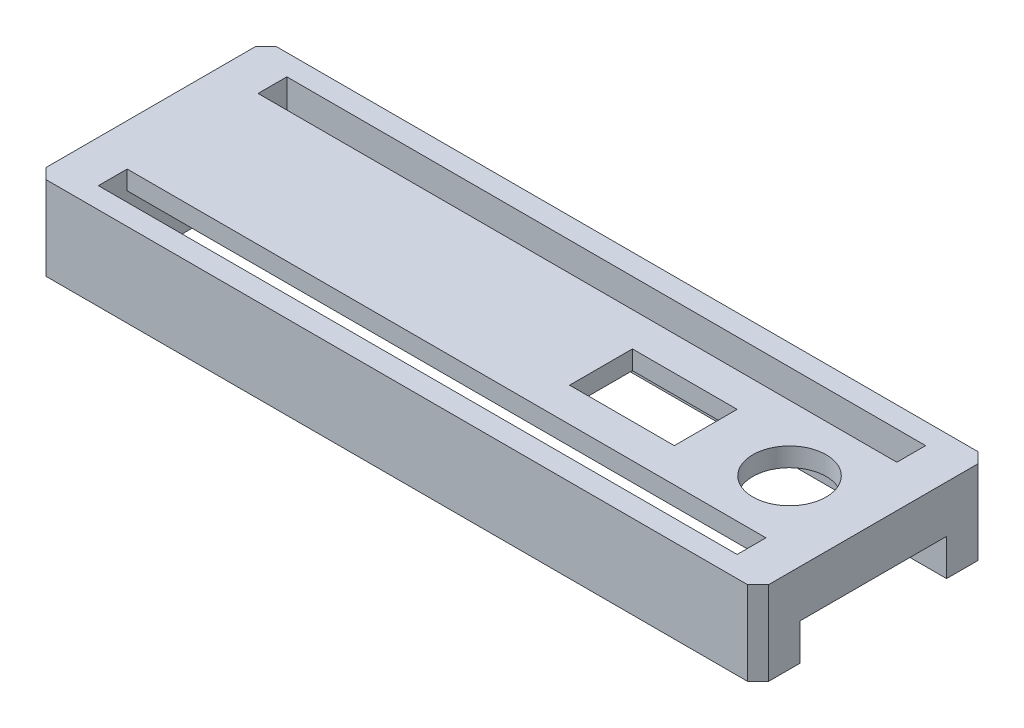
from build123d import *

# Parameters (mm, degrees)
SKETCH1_W                       = 70
SKETCH1_H                       = 12
BOSS_EXTRUDE1_DEPTH             = 1.8
SKETCH2_W                       = 4
SKETCH2_H                       = 18
BOSS_EXTRUDE2_DEPTH             = 8
BOSS_EXTRUDE3_REACH             = 40.58
SKETCH3_W                       = 5
SKETCH3_H                       = 18
BOSS_EXTRUDE3_DIRECTION_2_REACH = 40.58
SKETCH4_W                       = 5
SKETCH4_H                       = 14
CUT_EXTRUDE1_DEPTH              = 3.5
SKETCH5_W                       = 61
SKETCH5_H                       = 12.5
BOSS_EXTRUDE4_DEPTH             = 1.8
SKETCH7_W                       = 70
SKETCH7_H                       = 2
BOSS_EXTRUDE5_DEPTH             = 8
SKETCH10_R                      = 3.5
CUT_EXTRUDE2_DEPTH              = 1.8
SKETCH11_W                      = 10
SKETCH11_H                      = 6
CUT_EXTRUDE3_DEPTH              = 1.8
CUT_EXTRUDE4_START              = -8
SKETCH12_W                      = 1
SKETCH12_H                      = 22
CUT_EXTRUDE4_DEPTH              = 8
CHAMFER1_SIZE                   = 1


with BuildPart() as part:
    # Sketch1 → Boss-Extrude1 (new body)
    with BuildSketch(Plane(origin=(0, 0, 0), x_dir=(1, 0, 0), z_dir=(0, 1, 0))):
        with Locations((0, 6)):
            Rectangle(SKETCH1_W, SKETCH1_H)
    extrude(amount=BOSS_EXTRUDE1_DEPTH)

    # Sketch2 → Boss-Extrude2 (add)
    with BuildSketch(Plane(origin=(0, 1.8, 0), x_dir=(1, 0, 0), z_dir=(0, 1, 0))):
        with Locations((-33, 6)):
            Rectangle(SKETCH2_W, SKETCH2_H)
    extrude(amount=-BOSS_EXTRUDE2_DEPTH)

    # Boss-Extrude3: up to this face of the body (flat: up to its plane)
    boss_extrude3_end = Plane(part.part.faces().sort_by_distance((-33, -6.2, -6))[0])
    # Sketch3 → Boss-Extrude3 (add, up to the picked face)
    with BuildSketch(Plane.XZ, mode=Mode.PRIVATE) as boss_extrude3_sk1:
        with Locations((32.5, -6)):
            Rectangle(SKETCH3_W, SKETCH3_H)
    boss_extrude3_tool1 = split(extrude(boss_extrude3_sk1.sketch, amount=BOSS_EXTRUDE3_REACH, mode=Mode.PRIVATE), bisect_by=boss_extrude3_end, keep=Keep.BOTH, mode=Mode.PRIVATE)
    add(boss_extrude3_tool1.solids().sort_by(Axis((32.5, 0, -6), (0, -1, 0)))[0])

    # Boss-Extrude3 direction 2: up to this face of the body (flat: up to its plane)
    boss_extrude3_direction_2_end = Plane(part.part.faces().sort_by_distance((-0.916666667, 1.8, -6))[0])
    # Sketch3 → Boss-Extrude3 direction 2 (add, up to the picked face)
    with BuildSketch(Plane.XZ, mode=Mode.PRIVATE) as boss_extrude3_direction_2_sk1:
        with Locations((32.5, -6)):
            Rectangle(SKETCH3_W, SKETCH3_H)
    boss_extrude3_direction_2_tool1 = split(extrude(boss_extrude3_direction_2_sk1.sketch, amount=-BOSS_EXTRUDE3_DIRECTION_2_REACH, mode=Mode.PRIVATE), bisect_by=boss_extrude3_direction_2_end, keep=Keep.BOTH, mode=Mode.PRIVATE)
    add(boss_extrude3_direction_2_tool1.solids().sort_by(Axis((32.5, 0, -6), (0, 1, 0)))[0])

    # Sketch4 → Cut-Extrude1 (cut)
    with BuildSketch(Plane.XZ.offset(6.2)):
        with Locations((32.5, -6)):
            Rectangle(SKETCH4_W, SKETCH4_H)
    extrude(amount=-CUT_EXTRUDE1_DEPTH, mode=Mode.SUBTRACT)

    # Sketch5 → Boss-Extrude4 (add)
    with BuildSketch(Plane(origin=(0, 1.8, 0), x_dir=(1, 0, 0), z_dir=(0, 1, 0))):
        with Locations((-0.5, 6)):
            Rectangle(SKETCH5_W, SKETCH5_H)
    extrude(amount=-BOSS_EXTRUDE4_DEPTH)

    # Sketch7 → Boss-Extrude5 (add)
    with BuildSketch(Plane(origin=(0, 1.8, 0), x_dir=(1, 0, 0), z_dir=(0, 1, 0))):
        with Locations((0, 16)):
            Rectangle(SKETCH7_W, SKETCH7_H)
        with Locations((0, -4)):
            Rectangle(SKETCH7_W, SKETCH7_H)
    extrude(amount=-BOSS_EXTRUDE5_DEPTH)

    # Sketch10 → Cut-Extrude2 (cut)
    with BuildSketch(Plane(origin=(0, 1.8, 0), x_dir=(1, 0, 0), z_dir=(0, 1, 0))):
        with Locations(Location((26, 6, 0), (0, 0, 270))):
            Circle(SKETCH10_R)
    extrude(amount=-CUT_EXTRUDE2_DEPTH, mode=Mode.SUBTRACT)

    # Sketch11 → Cut-Extrude3 (cut)
    with BuildSketch(Plane(origin=(0, 1.8, 0), x_dir=(1, 0, 0), z_dir=(0, 1, 0))):
        with Locations((13, 6)):
            Rectangle(SKETCH11_W, SKETCH11_H)
    extrude(amount=-CUT_EXTRUDE3_DEPTH, mode=Mode.SUBTRACT)

    # Sketch12 → Cut-Extrude4 (cut)
    with BuildSketch(Plane(origin=(0, 1.8, 0), x_dir=(1, 0, 0), z_dir=(0, 1, 0)).offset(CUT_EXTRUDE4_START)):
        with Locations((34.5, 6)):
            Rectangle(SKETCH12_W, SKETCH12_H)
    extrude(amount=CUT_EXTRUDE4_DEPTH, mode=Mode.SUBTRACT)

    # Chamfer1
    chamfer1_edges = [part.edges().sort_by_distance(p)[0] for p in [
        (-35, -2.2, -17),
        (-35, -2.2, 5),
        (34, -2.2, 5),
        (34, -2.2, -17),
    ]]
    chamfer(chamfer1_edges, length=CHAMFER1_SIZE)


solid = part.part
